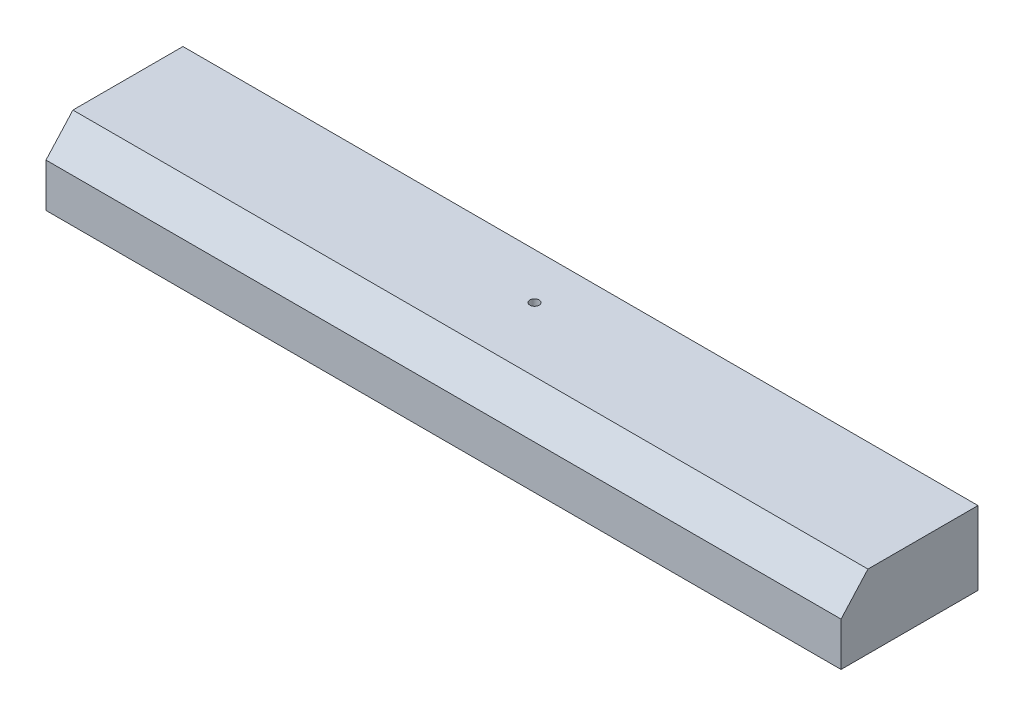
from build123d import *
from build123d.topology import SkipClean

# Parameters (mm, degrees)
SKETCH2_W               = 173
SKETCH2_H               = 29.8
BOSS_EXTRUDE1_DEPTH     = 14
SKETCH4_W               = 173
SKETCH4_H               = 29.8
SKETCH4_R               = 1
BOSS_EXTRUDE3_DEPTH     = 2
BOSS_EXTRUDE4_START     = 5.5
SKETCH5_R               = 1
BOSS_EXTRUDE4_DEPTH     = 5.5
CUT_EXTRUDE1_DEPTH      = 91.874033815
CUT_EXTRUDE1_DEPTH_BACK = 91.874033815


with BuildPart() as part:
    # Sketch2 → Boss-Extrude1 (new body)
    with BuildSketch(Plane(origin=(0, 0, 0), x_dir=(1, 0, 0), z_dir=(0, 1, 0))):
        with Locations((0, 7.9)):
            Rectangle(SKETCH2_W, SKETCH2_H)
        with BuildLine():
            Line((-81.5, 0), (81.5, 0))
            add(Edge.make_bspline(
                [(-81.5, 0), (-74.436091259, 13.881927863), (-43.259356961, 16.362188276), (0, 18.555927536), (43.259356961, 16.362188276), (74.436091259, 13.881927863), (81.5, 0)],
                knots=[0, 0, 0, 0, 0.237125688, 0.5, 0.762874312, 1, 1, 1, 1], degree=3))
        make_face(mode=Mode.SUBTRACT)
    extrude(amount=BOSS_EXTRUDE1_DEPTH)

    # Sketch4 → Boss-Extrude3 (add)
    with BuildSketch(Plane(origin=(0, 14, 0), x_dir=(1, 0, 0), z_dir=(0, 1, 0))):
        with Locations((0, 7.9)):
            Rectangle(SKETCH4_W, SKETCH4_H)
        with Locations(Location((0, 12.8, 0), (0, 0, 270))):
            Circle(SKETCH4_R, mode=Mode.SUBTRACT)
    extrude(amount=BOSS_EXTRUDE3_DEPTH)

    # Sketch5 → Boss-Extrude4 (add)
    with SkipClean():  # the faces are left unmerged after this step: merging them gives an invalid solid
        with BuildSketch(Plane.XZ.offset(-14).offset(BOSS_EXTRUDE4_START)):
            Polygon((0, -9.8), (-7.931348641, -17.731348641), (-7.931348641, -22.8), (7.931348641, -22.8), (7.931348641, -17.731348641), align=None)
            with Locations(Location((0, -12.8, 0), (0, 0, 270))):
                Circle(SKETCH5_R, mode=Mode.SUBTRACT)
        extrude(amount=-BOSS_EXTRUDE4_DEPTH)

    # Sketch3 → Cut-Extrude1 (cut, two sides: drawn at the far end of the back side and taken through both)
    with SkipClean():  # the faces are left unmerged after this step: merging them gives an invalid solid
        with BuildSketch(Plane(origin=(0, 0, 0), x_dir=(0, 0, -1), z_dir=(1, 0, 0)).offset(-CUT_EXTRUDE1_DEPTH_BACK)):
            Polygon((-48.86878806, -37), (4.996225752, 22.823158451), (1.280501625, 26.168811483), (-52.584512187, -33.654346968), align=None)
        extrude(amount=CUT_EXTRUDE1_DEPTH + CUT_EXTRUDE1_DEPTH_BACK, mode=Mode.SUBTRACT)


solid = part.part
